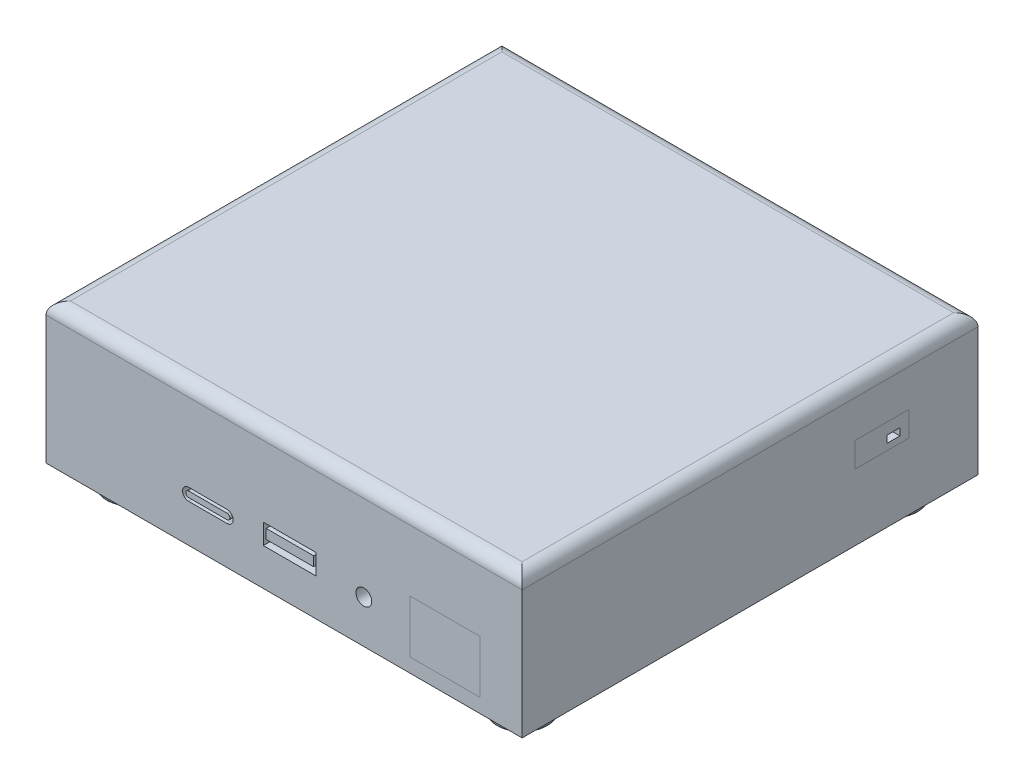
from build123d import *

# Parameters (mm, degrees)
SKETCH_2_W          = 117
SKETCH_2_H          = 112
EXTRUDE_1_DEPTH     = 34.5
FILLET_1_R          = 3
SKETCH_5_R          = 1.94319569
SKETCH_5_W          = 13
SKETCH_5_H          = 5
SKETCH_5_W_2        = 11.655581837
SKETCH_5_H_2        = 2.33697436
CUT_EXTRUDE_1_DEPTH = 34.5
SKETCH_7_W          = 3.12128514
SKETCH_7_H          = 1.749384405
CUT_EXTRUDE_2_DEPTH = 34.5
SKETCH_9_W          = 12.023305714
SKETCH_9_H          = 0.702782293
SKETCH_9_R          = 3.105468951
SKETCH_9_R_2        = 1.268882641
SKETCH_9_W_2        = 12.933693937
SKETCH_9_H_2        = 7.702330062
SKETCH_9_W_3        = 7.704150903
SKETCH_9_H_3        = 2.128244441
SKETCH_9_W_4        = 10.462177884
SKETCH_9_H_4        = 5.279264431
SKETCH_9_W_5        = 7
SKETCH_9_H_5        = 1.91211105
SKETCH_9_H_6        = 5.213763305
SKETCH_9_H_7        = 1.542759432
CUT_EXTRUDE_3_DEPTH = 34.5
SKETCH_11_W         = 26.414855416
SKETCH_11_H         = 1.499589485
CUT_EXTRUDE_4_DEPTH = 34.5
SKETCH_13_R         = 6.25
EXTRUDE_2_DEPTH     = 5
SKETCH_14_R         = 4
CUT_EXTRUDE_5_DEPTH = 5
SKETCH_15_R         = 1.5
CUT_EXTRUDE_6_DEPTH = 5
CUT_EXTRUDE_7_DEPTH = 1
FILLET_2_R          = 3
FILLET_3_R          = 0.5
SKETCH_17_R         = 1.25
CUT_EXTRUDE_8_DEPTH = 10


with BuildPart() as part:
    # 草图2 → 凸台-拉伸1 (new body)
    with BuildSketch(Plane(origin=(0, 0, 0), x_dir=(1, 0, 0), z_dir=(0, 1, 0))):
        Rectangle(SKETCH_2_W, SKETCH_2_H)
    extrude(amount=EXTRUDE_1_DEPTH)

    # 圆角1
    fillet_1_edges = [part.edges().sort_by_distance(p)[0] for p in [
        (-58.5, 34.5, 0),
        (0, 34.5, 56),
        (58.5, 34.5, 0),
        (0, 34.5, -56),
    ]]
    fillet(fillet_1_edges, radius=FILLET_1_R)

    # 草图5 → 切除-拉伸1 (cut)
    # profile 1 of 3: a face of its own
    with BuildSketch(Plane.XY.offset(56)):
        with Locations((19.594569858, 10.537289657)):
            Circle(SKETCH_5_R)
    # profile 2 of 3: a face of its own
    with BuildSketch(Plane.XY.offset(56)):
        with Locations((1.387582533, 11.639469252)):
            Rectangle(SKETCH_5_W, SKETCH_5_H)
        with Locations((1.418326707, 11.970982072)):
            Rectangle(SKETCH_5_W_2, SKETCH_5_H_2, mode=Mode.SUBTRACT)
    # profile 3 of 3: a face of its own
    with BuildSketch(Plane.XY.offset(56)):
        with BuildLine():
            Line((-23.453277439, 12.376301325), (-14.013410674, 12.376301325))
            ThreePointArc((-14.013410674, 12.376301325), (-12.513410674, 10.876301325), (-14.013410674, 9.376301325))
            Line((-14.013410674, 9.376301325), (-23.453277439, 9.376301325))
            ThreePointArc((-23.453277439, 9.376301325), (-24.953277439, 10.876301325), (-23.453277439, 12.376301325))
        make_face()
        with BuildLine():
            Line((-23.453277439, 11.576301325), (-14.013410674, 11.576301325))
            ThreePointArc((-14.013410674, 11.576301325), (-13.313410674, 10.876301325), (-14.013410674, 10.176301325))
            Line((-14.013410674, 10.176301325), (-23.453277439, 10.176301325))
            ThreePointArc((-23.453277439, 10.176301325), (-24.153277439, 10.876301325), (-23.453277439, 11.576301325))
        make_face(mode=Mode.SUBTRACT)
    extrude(amount=-CUT_EXTRUDE_1_DEPTH, mode=Mode.SUBTRACT)

    # 草图7 → 切除-拉伸2 (cut)
    with BuildSketch(Plane(origin=(58.5, 0, 0), x_dir=(0, 0, -1), z_dir=(1, 0, 0))):
        with Locations((35.251062041, 18.745661738)):
            Rectangle(SKETCH_7_W, SKETCH_7_H)
    extrude(amount=-CUT_EXTRUDE_2_DEPTH, mode=Mode.SUBTRACT)

    # 草图9 → 切除-拉伸3 (cut)
    # profile 1 of 21: a face of its own
    with BuildSketch(Plane(origin=(0, 0, -56), x_dir=(-1, 0, 0), z_dir=(0, 0, -1))):
        with BuildLine():
            ThreePointArc((-35.950498544, 11.544599726), (-34.777577949, 12.001879174), (-34.223677194, 13.132384002))
            Line((-34.223677194, 13.132384002), (-27.359684331, 13.132384002))
            Line((-27.359684331, 13.132384002), (-19.927828097, 13.132384002))
            ThreePointArc((-19.927828097, 13.132384002), (-19.656996341, 12.194159761), (-18.927828097, 11.544599726))
            Line((-18.927828097, 11.544599726), (-18.927828097, 8.613731529))
            Line((-18.927828097, 8.613731529), (-35.950498544, 8.613731529))
            Line((-35.950498544, 8.613731529), (-35.950498544, 11.544599726))
        make_face()
        with Locations((-26.730939637, 10.073758574)):
            Rectangle(SKETCH_9_W, SKETCH_9_H, mode=Mode.SUBTRACT)
    # profile 2 of 21: a face of its own
    with BuildSketch(Plane(origin=(0, 0, -56), x_dir=(-1, 0, 0), z_dir=(0, 0, -1))):
        with Locations((-47.942536707, 10.42514972)):
            Circle(SKETCH_9_R)
        with Locations((-47.942536707, 10.42514972)):
            Circle(SKETCH_9_R_2, mode=Mode.SUBTRACT)
    # profile 3 of 21: a face of its own
    with BuildSketch(Plane(origin=(0, 0, -56), x_dir=(-1, 0, 0), z_dir=(0, 0, -1))):
        with Locations((-3.756830225, 12.46489656)):
            Rectangle(SKETCH_9_W_2, SKETCH_9_H_2)
    # profile 4 of 21: a face of its own
    with BuildSketch(Plane(origin=(0, 0, -56), x_dir=(-1, 0, 0), z_dir=(0, 0, -1))):
        with Locations((-3.075752646, 7.549609309)):
            Rectangle(SKETCH_9_W_3, SKETCH_9_H_3)
    # profile 5 of 21: a face of its own
    with BuildSketch(Plane(origin=(0, 0, -56), x_dir=(-1, 0, 0), z_dir=(0, 0, -1))):
        with Locations((16.303260845, 13.676429375)):
            Rectangle(SKETCH_9_W_4, SKETCH_9_H_4)
        with Locations((16.276322806, 14.632484901)):
            Rectangle(SKETCH_9_W_5, SKETCH_9_H_5, mode=Mode.SUBTRACT)
    # profile 6 of 21: a face of its own
    with BuildSketch(Plane(origin=(0, 0, -56), x_dir=(-1, 0, 0), z_dir=(0, 0, -1))):
        with Locations((16.303260845, 6.006849877)):
            Rectangle(SKETCH_9_W_4, SKETCH_9_H_6)
        with Locations((16.276322806, 6.778229593)):
            Rectangle(SKETCH_9_W_5, SKETCH_9_H_7, mode=Mode.SUBTRACT)
    # profile 7 of 21: a face of its own
    with BuildSketch(Plane(origin=(0, 0, -56), x_dir=(-1, 0, 0), z_dir=(0, 0, -1))):
        with BuildLine():
            Line((31.367178921, 13.835844061), (38.401088463, 13.835844061))
            ThreePointArc((38.401088463, 13.835844061), (40.153784829, 15.588540426), (38.401088463, 17.341236792))
            Line((38.401088463, 17.341236792), (31.367178921, 17.341236792))
            ThreePointArc((31.367178921, 17.341236792), (29.614482555, 15.588540426), (31.367178921, 13.835844061))
        make_face()
        with BuildLine():
            ThreePointArc((38.401088463, 15.199333705), (38.790295184, 15.588540426), (38.401088463, 15.977747147))
            Line((38.401088463, 15.977747147), (31.367178921, 15.977747147))
            ThreePointArc((31.367178921, 15.977747147), (30.977972199, 15.588540426), (31.367178921, 15.199333705))
            Line((31.367178921, 15.199333705), (38.401088463, 15.199333705))
        make_face(mode=Mode.SUBTRACT)
    # profile 8 of 21: a face of its own
    with BuildSketch(Plane(origin=(0, 0, -56), x_dir=(-1, 0, 0), z_dir=(0, 0, -1))):
        with BuildLine():
            Line((35.072171903, 20.278921559), (36.776322806, 20.278921559))
            ThreePointArc((36.776322806, 20.278921559), (37.483429588, 20.571814778), (37.776322806, 21.278921559))
            Line((37.776322806, 21.278921559), (37.776322806, 26.966804486))
            ThreePointArc((37.776322806, 26.966804486), (37.483429588, 27.673911268), (36.776322806, 27.966804486))
            Line((36.776322806, 27.966804486), (35.072171903, 27.966804486))
            ThreePointArc((35.072171903, 27.966804486), (34.365065122, 27.673911268), (34.072171903, 26.966804486))
            Line((34.072171903, 26.966804486), (34.072171903, 21.278921559))
            ThreePointArc((34.072171903, 21.278921559), (34.365065122, 20.571814778), (35.072171903, 20.278921559))
        make_face()
    # profile 9 of 21: a face of its own
    with BuildSketch(Plane(origin=(0, 0, -56), x_dir=(-1, 0, 0), z_dir=(0, 0, -1))):
        with BuildLine():
            Line((29.072171903, 20.278921559), (30.776322806, 20.278921559))
            ThreePointArc((30.776322806, 20.278921559), (31.483429588, 20.571814778), (31.776322806, 21.278921559))
            Line((31.776322806, 21.278921559), (31.776322806, 26.966804486))
            ThreePointArc((31.776322806, 26.966804486), (31.483429588, 27.673911268), (30.776322806, 27.966804486))
            Line((30.776322806, 27.966804486), (29.072171903, 27.966804486))
            ThreePointArc((29.072171903, 27.966804486), (28.365065122, 27.673911268), (28.072171903, 26.966804486))
            Line((28.072171903, 26.966804486), (28.072171903, 21.278921559))
            ThreePointArc((28.072171903, 21.278921559), (28.365065122, 20.571814778), (29.072171903, 20.278921559))
        make_face()
    # profile 10 of 21: a face of its own
    with BuildSketch(Plane(origin=(0, 0, -56), x_dir=(-1, 0, 0), z_dir=(0, 0, -1))):
        with BuildLine():
            Line((23.072171903, 20.278921559), (24.776322806, 20.278921559))
            ThreePointArc((24.776322806, 20.278921559), (25.483429588, 20.571814778), (25.776322806, 21.278921559))
            Line((25.776322806, 21.278921559), (25.776322806, 26.966804486))
            ThreePointArc((25.776322806, 26.966804486), (25.483429588, 27.673911268), (24.776322806, 27.966804486))
            Line((24.776322806, 27.966804486), (23.072171903, 27.966804486))
            ThreePointArc((23.072171903, 27.966804486), (22.365065122, 27.673911268), (22.072171903, 26.966804486))
            Line((22.072171903, 26.966804486), (22.072171903, 21.278921559))
            ThreePointArc((22.072171903, 21.278921559), (22.365065122, 20.571814778), (23.072171903, 20.278921559))
        make_face()
    # profile 11 of 21: a face of its own
    with BuildSketch(Plane(origin=(0, 0, -56), x_dir=(-1, 0, 0), z_dir=(0, 0, -1))):
        with BuildLine():
            Line((17.072171903, 20.278921559), (18.776322806, 20.278921559))
            ThreePointArc((18.776322806, 20.278921559), (19.483429588, 20.571814778), (19.776322806, 21.278921559))
            Line((19.776322806, 21.278921559), (19.776322806, 26.966804486))
            ThreePointArc((19.776322806, 26.966804486), (19.483429588, 27.673911268), (18.776322806, 27.966804486))
            Line((18.776322806, 27.966804486), (17.072171903, 27.966804486))
            ThreePointArc((17.072171903, 27.966804486), (16.365065122, 27.673911268), (16.072171903, 26.966804486))
            Line((16.072171903, 26.966804486), (16.072171903, 21.278921559))
            ThreePointArc((16.072171903, 21.278921559), (16.365065122, 20.571814778), (17.072171903, 20.278921559))
        make_face()
    # profile 12 of 21: a face of its own
    with BuildSketch(Plane(origin=(0, 0, -56), x_dir=(-1, 0, 0), z_dir=(0, 0, -1))):
        with BuildLine():
            Line((11.072171903, 20.278921559), (12.776322806, 20.278921559))
            ThreePointArc((12.776322806, 20.278921559), (13.483429588, 20.571814778), (13.776322806, 21.278921559))
            Line((13.776322806, 21.278921559), (13.776322806, 26.966804486))
            ThreePointArc((13.776322806, 26.966804486), (13.483429588, 27.673911268), (12.776322806, 27.966804486))
            Line((12.776322806, 27.966804486), (11.072171903, 27.966804486))
            ThreePointArc((11.072171903, 27.966804486), (10.365065122, 27.673911268), (10.072171903, 26.966804486))
            Line((10.072171903, 26.966804486), (10.072171903, 21.278921559))
            ThreePointArc((10.072171903, 21.278921559), (10.365065122, 20.571814778), (11.072171903, 20.278921559))
        make_face()
    # profile 13 of 21: a face of its own
    with BuildSketch(Plane(origin=(0, 0, -56), x_dir=(-1, 0, 0), z_dir=(0, 0, -1))):
        with BuildLine():
            Line((5.072171903, 20.278921559), (6.776322806, 20.278921559))
            ThreePointArc((6.776322806, 20.278921559), (7.483429588, 20.571814778), (7.776322806, 21.278921559))
            Line((7.776322806, 21.278921559), (7.776322806, 26.966804486))
            ThreePointArc((7.776322806, 26.966804486), (7.483429588, 27.673911268), (6.776322806, 27.966804486))
            Line((6.776322806, 27.966804486), (5.072171903, 27.966804486))
            ThreePointArc((5.072171903, 27.966804486), (4.365065122, 27.673911268), (4.072171903, 26.966804486))
            Line((4.072171903, 26.966804486), (4.072171903, 21.278921559))
            ThreePointArc((4.072171903, 21.278921559), (4.365065122, 20.571814778), (5.072171903, 20.278921559))
        make_face()
    # profile 14 of 21: a face of its own
    with BuildSketch(Plane(origin=(0, 0, -56), x_dir=(-1, 0, 0), z_dir=(0, 0, -1))):
        with BuildLine():
            Line((-0.927828097, 20.278921559), (0.776322806, 20.278921559))
            ThreePointArc((0.776322806, 20.278921559), (1.483429588, 20.571814778), (1.776322806, 21.278921559))
            Line((1.776322806, 21.278921559), (1.776322806, 26.966804486))
            ThreePointArc((1.776322806, 26.966804486), (1.483429588, 27.673911268), (0.776322806, 27.966804486))
            Line((0.776322806, 27.966804486), (-0.927828097, 27.966804486))
            ThreePointArc((-0.927828097, 27.966804486), (-1.634934878, 27.673911268), (-1.927828097, 26.966804486))
            Line((-1.927828097, 26.966804486), (-1.927828097, 21.278921559))
            ThreePointArc((-1.927828097, 21.278921559), (-1.634934878, 20.571814778), (-0.927828097, 20.278921559))
        make_face()
    # profile 15 of 21: a face of its own
    with BuildSketch(Plane(origin=(0, 0, -56), x_dir=(-1, 0, 0), z_dir=(0, 0, -1))):
        with BuildLine():
            Line((-6.927828097, 20.278921559), (-5.223677194, 20.278921559))
            ThreePointArc((-5.223677194, 20.278921559), (-4.516570412, 20.571814778), (-4.223677194, 21.278921559))
            Line((-4.223677194, 21.278921559), (-4.223677194, 26.966804486))
            ThreePointArc((-4.223677194, 26.966804486), (-4.516570412, 27.673911268), (-5.223677194, 27.966804486))
            Line((-5.223677194, 27.966804486), (-6.927828097, 27.966804486))
            ThreePointArc((-6.927828097, 27.966804486), (-7.634934878, 27.673911268), (-7.927828097, 26.966804486))
            Line((-7.927828097, 26.966804486), (-7.927828097, 21.278921559))
            ThreePointArc((-7.927828097, 21.278921559), (-7.634934878, 20.571814778), (-6.927828097, 20.278921559))
        make_face()
    # profile 16 of 21: a face of its own
    with BuildSketch(Plane(origin=(0, 0, -56), x_dir=(-1, 0, 0), z_dir=(0, 0, -1))):
        with BuildLine():
            Line((-12.927828097, 20.278921559), (-11.223677194, 20.278921559))
            ThreePointArc((-11.223677194, 20.278921559), (-10.516570412, 20.571814778), (-10.223677194, 21.278921559))
            Line((-10.223677194, 21.278921559), (-10.223677194, 26.966804486))
            ThreePointArc((-10.223677194, 26.966804486), (-10.516570412, 27.673911268), (-11.223677194, 27.966804486))
            Line((-11.223677194, 27.966804486), (-12.927828097, 27.966804486))
            ThreePointArc((-12.927828097, 27.966804486), (-13.634934878, 27.673911268), (-13.927828097, 26.966804486))
            Line((-13.927828097, 26.966804486), (-13.927828097, 21.278921559))
            ThreePointArc((-13.927828097, 21.278921559), (-13.634934878, 20.571814778), (-12.927828097, 20.278921559))
        make_face()
    # profile 17 of 21: a face of its own
    with BuildSketch(Plane(origin=(0, 0, -56), x_dir=(-1, 0, 0), z_dir=(0, 0, -1))):
        with BuildLine():
            Line((-18.927828097, 20.278921559), (-17.223677194, 20.278921559))
            ThreePointArc((-17.223677194, 20.278921559), (-16.516570412, 20.571814778), (-16.223677194, 21.278921559))
            Line((-16.223677194, 21.278921559), (-16.223677194, 26.966804486))
            ThreePointArc((-16.223677194, 26.966804486), (-16.516570412, 27.673911268), (-17.223677194, 27.966804486))
            Line((-17.223677194, 27.966804486), (-18.927828097, 27.966804486))
            ThreePointArc((-18.927828097, 27.966804486), (-19.634934878, 27.673911268), (-19.927828097, 26.966804486))
            Line((-19.927828097, 26.966804486), (-19.927828097, 21.278921559))
            ThreePointArc((-19.927828097, 21.278921559), (-19.634934878, 20.571814778), (-18.927828097, 20.278921559))
        make_face()
    # profile 18 of 21: a face of its own
    with BuildSketch(Plane(origin=(0, 0, -56), x_dir=(-1, 0, 0), z_dir=(0, 0, -1))):
        with BuildLine():
            Line((-24.927828097, 20.278921559), (-23.223677194, 20.278921559))
            ThreePointArc((-23.223677194, 20.278921559), (-22.516570412, 20.571814778), (-22.223677194, 21.278921559))
            Line((-22.223677194, 21.278921559), (-22.223677194, 26.966804486))
            ThreePointArc((-22.223677194, 26.966804486), (-22.516570412, 27.673911268), (-23.223677194, 27.966804486))
            Line((-23.223677194, 27.966804486), (-24.927828097, 27.966804486))
            ThreePointArc((-24.927828097, 27.966804486), (-25.634934878, 27.673911268), (-25.927828097, 26.966804486))
            Line((-25.927828097, 26.966804486), (-25.927828097, 21.278921559))
            ThreePointArc((-25.927828097, 21.278921559), (-25.634934878, 20.571814778), (-24.927828097, 20.278921559))
        make_face()
    # profile 19 of 21: a face of its own
    with BuildSketch(Plane(origin=(0, 0, -56), x_dir=(-1, 0, 0), z_dir=(0, 0, -1))):
        with BuildLine():
            Line((-30.927828097, 20.278921559), (-29.223677194, 20.278921559))
            ThreePointArc((-29.223677194, 20.278921559), (-28.516570412, 20.571814778), (-28.223677194, 21.278921559))
            Line((-28.223677194, 21.278921559), (-28.223677194, 26.966804486))
            ThreePointArc((-28.223677194, 26.966804486), (-28.516570412, 27.673911268), (-29.223677194, 27.966804486))
            Line((-29.223677194, 27.966804486), (-30.927828097, 27.966804486))
            ThreePointArc((-30.927828097, 27.966804486), (-31.634934878, 27.673911268), (-31.927828097, 26.966804486))
            Line((-31.927828097, 26.966804486), (-31.927828097, 21.278921559))
            ThreePointArc((-31.927828097, 21.278921559), (-31.634934878, 20.571814778), (-30.927828097, 20.278921559))
        make_face()
    # profile 20 of 21: a face of its own
    with BuildSketch(Plane(origin=(0, 0, -56), x_dir=(-1, 0, 0), z_dir=(0, 0, -1))):
        with BuildLine():
            Line((-36.927828097, 20.278921559), (-35.223677194, 20.278921559))
            ThreePointArc((-35.223677194, 20.278921559), (-34.516570412, 20.571814778), (-34.223677194, 21.278921559))
            Line((-34.223677194, 21.278921559), (-34.223677194, 26.966804486))
            ThreePointArc((-34.223677194, 26.966804486), (-34.516570412, 27.673911268), (-35.223677194, 27.966804486))
            Line((-35.223677194, 27.966804486), (-36.927828097, 27.966804486))
            ThreePointArc((-36.927828097, 27.966804486), (-37.634934878, 27.673911268), (-37.927828097, 26.966804486))
            Line((-37.927828097, 26.966804486), (-37.927828097, 21.278921559))
            ThreePointArc((-37.927828097, 21.278921559), (-37.634934878, 20.571814778), (-36.927828097, 20.278921559))
        make_face()
    # profile 21 of 21: a face of its own
    with BuildSketch(Plane(origin=(0, 0, -56), x_dir=(-1, 0, 0), z_dir=(0, 0, -1))):
        with BuildLine():
            ThreePointArc((-43.927828097, 26.966804486), (-43.634934878, 27.673911268), (-42.927828097, 27.966804486))
            Line((-42.927828097, 27.966804486), (-41.223677194, 27.966804486))
            ThreePointArc((-41.223677194, 27.966804486), (-40.516570412, 27.673911268), (-40.223677194, 26.966804486))
            Line((-40.223677194, 26.966804486), (-40.223677194, 21.278921559))
            ThreePointArc((-40.223677194, 21.278921559), (-40.516570412, 20.571814778), (-41.223677194, 20.278921559))
            Line((-41.223677194, 20.278921559), (-42.927828097, 20.278921559))
            ThreePointArc((-42.927828097, 20.278921559), (-43.634934878, 20.571814778), (-43.927828097, 21.278921559))
            Line((-43.927828097, 21.278921559), (-43.927828097, 26.966804486))
        make_face()
    extrude(amount=-CUT_EXTRUDE_3_DEPTH, mode=Mode.SUBTRACT)

    # 草图11 → 切除-拉伸4 (cut)
    with BuildSketch(Plane.ZY.offset(58.5)):
        with Locations((27.293913372, 15.341122477)):
            Rectangle(SKETCH_11_W, SKETCH_11_H)
    extrude(amount=-CUT_EXTRUDE_4_DEPTH, mode=Mode.SUBTRACT)

    # 草图13 → 凸台-拉伸2 (add)
    with BuildSketch(Plane.XZ):
        with Locations(Location((48, 45.5, 0), (0, 0, 270))):
            Circle(SKETCH_13_R)
        with Locations(Location((48, -45.5, 0), (0, 0, 270))):
            Circle(SKETCH_13_R)
        with Locations(Location((-48, 45.5, 0), (0, 0, 270))):
            Circle(SKETCH_13_R)
        with Locations(Location((-48, -45.5, 0), (0, 0, 270))):
            Circle(SKETCH_13_R)
    extrude(amount=EXTRUDE_2_DEPTH)

    # 草图14 → 切除-拉伸5 (cut)
    with BuildSketch(Plane.XZ.offset(5)):
        with Locations(Location((48, 45.5, 0), (0, 0, 270))):
            Circle(SKETCH_14_R)
        with Locations(Location((48, -45.5, 0), (0, 0, 270))):
            Circle(SKETCH_14_R)
        with Locations(Location((-48, 45.5, 0), (0, 0, 270))):
            Circle(SKETCH_14_R)
        with Locations(Location((-48, -45.5, 0), (0, 0, 270))):
            Circle(SKETCH_14_R)
    extrude(amount=-CUT_EXTRUDE_5_DEPTH, mode=Mode.SUBTRACT)

    # 草图15 → 切除-拉伸6 (cut)
    with BuildSketch(Plane.XZ):
        with Locations(Location((0, 42.5, 0), (0, 0, 270))):
            Circle(SKETCH_15_R)
        with Locations(Location((0, -42.5, 0), (0, 0, 90))):
            Circle(SKETCH_15_R)
    extrude(amount=-CUT_EXTRUDE_6_DEPTH, mode=Mode.SUBTRACT)

    # 草图16 → 切除-拉伸7 (cut)
    with BuildSketch(Plane.XZ):
        with BuildLine():
            ThreePointArc((33, -45.5), (37.393398282, -34.893398282), (48, -30.5))
            Line((48, -30.5), (48, 30.5))
            ThreePointArc((48, 30.5), (37.393398282, 34.893398282), (33, 45.5))
            Line((33, 45.5), (11.971550157, 45.5))
            Line((11.971550157, 45.5), (4.383302564, 37.30509973))
            Line((4.383302564, 37.30509973), (3.340411246, 37.30509973))
            Line((3.340411246, 37.30509973), (-3.340411246, 37.30509973))
            Line((-3.340411246, 37.30509973), (-4.383302564, 37.30509973))
            Line((-4.383302564, 37.30509973), (-11.971550157, 45.5))
            Line((-11.971550157, 45.5), (-33, 45.5))
            ThreePointArc((-33, 45.5), (-37.393398282, 34.893398282), (-48, 30.5))
            Line((-48, 30.5), (-48, -30.5))
            ThreePointArc((-48, -30.5), (-37.393398282, -34.893398282), (-33, -45.5))
            Line((-33, -45.5), (-11.971550157, -45.5))
            Line((-11.971550157, -45.5), (-4.383302564, -37.30509973))
            Line((-4.383302564, -37.30509973), (-3.340411246, -37.30509973))
            Line((-3.340411246, -37.30509973), (3.340411246, -37.30509973))
            Line((3.340411246, -37.30509973), (4.383302564, -37.30509973))
            Line((4.383302564, -37.30509973), (11.971550157, -45.5))
            Line((11.971550157, -45.5), (33, -45.5))
        make_face()
    extrude(amount=-CUT_EXTRUDE_7_DEPTH, mode=Mode.SUBTRACT)

    # 圆角2
    fillet_2_edges = [part.edges().sort_by_distance(p)[0] for p in [
        (-48, 0.5, 30.5),
        (-33, 0.5, 45.5),
        (-11.971550157, 0.5, 45.5),
        (-4.383302564, 0.5, 37.30509973),
        (4.383302564, 0.5, 37.30509973),
        (11.971550157, 0.5, 45.5),
        (33, 0.5, 45.5),
        (48, 0.5, 30.5),
        (48, 0.5, -30.5),
        (33, 0.5, -45.5),
        (11.971550157, 0.5, -45.5),
        (4.383302564, 0.5, -37.30509973),
        (-4.383302564, 0.5, -37.30509973),
        (-11.971550157, 0.5, -45.5),
        (-33, 0.5, -45.5),
        (-48, 0.5, -30.5),
    ]]
    fillet(fillet_2_edges, radius=FILLET_2_R)

    # 圆角3
    fillet_3_edges = [part.edges().sort_by_distance(p)[0] for p in [
        (48, -5, 51.75),
        (48, -5, -39.25),
        (-48, -5, 51.75),
        (-48, -5, -39.25),
        (48, -5, -41.5),
        (-48, -5, 49.5),
        (-48, -5, -41.5),
        (48, -5, 49.5),
    ]]
    fillet(fillet_3_edges, radius=FILLET_3_R)

    # 草图17 → 切除-拉伸8 (cut)
    with BuildSketch(Plane.XZ):
        with Locations(Location((48, 45.5, 0), (0, 0, 270))):
            Circle(SKETCH_17_R)
        with Locations(Location((48, -45.5, 0), (0, 0, 270))):
            Circle(SKETCH_17_R)
        with Locations(Location((-48, 45.5, 0), (0, 0, 270))):
            Circle(SKETCH_17_R)
        with Locations(Location((-48, -45.5, 0), (0, 0, 270))):
            Circle(SKETCH_17_R)
    extrude(amount=-CUT_EXTRUDE_8_DEPTH, mode=Mode.SUBTRACT)


solid = part.part
